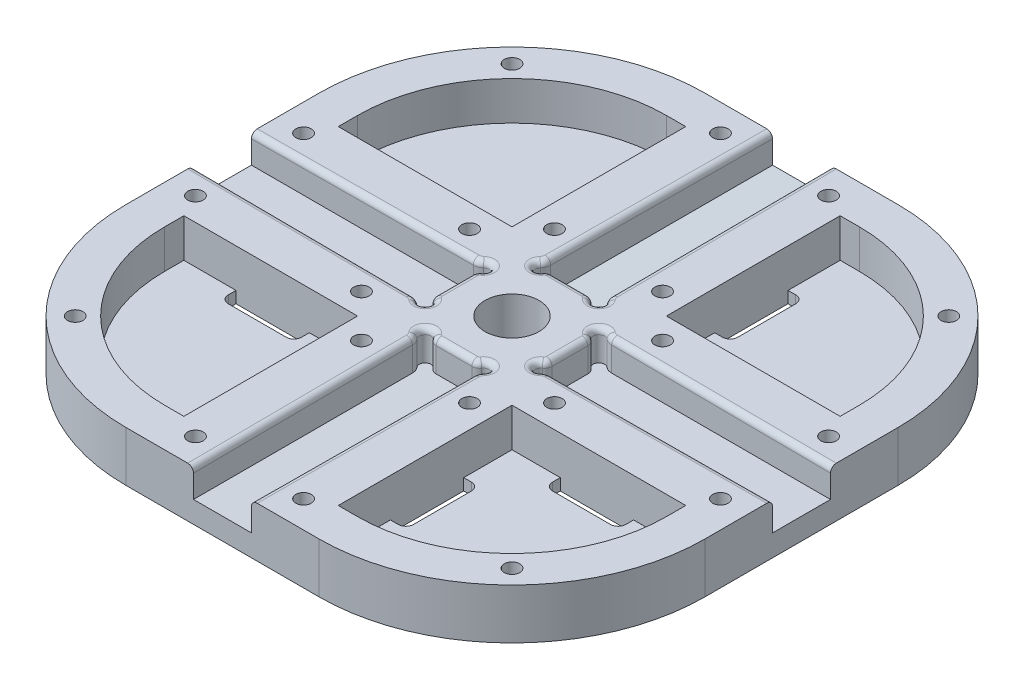
from build123d import *

# Parameters (mm, degrees)
BASE_EXTRUDE1_DEPTH = 13
TUBEPLACE_CUT_DEPTH = 7.4
DRAFT3_ANGLE        = -0.4
DRAFT4_ANGLE        = -0.4
DRAFT5_ANGLE        = -0.4
DRAFT6_ANGLE        = -0.4
SKETCH3_R           = 7
CUT_EXTRUDE2_DEPTH  = 10
CUT_EXTRUDE3_DEPTH  = 107.536378763
FILLET1_R           = 3
FILLET2_R           = 1.5
SKETCH5_R           = 2
CUT_EXTRUDE4_DEPTH  = 107.85972113
SKETCH6_R           = 3.5
CUT_EXTRUDE5_DEPTH  = 9


with BuildPart() as part:
    # Sketch1 → Base-Extrude1 (new body)
    with BuildSketch(Plane(origin=(0, 0, 0), x_dir=(1, 0, 0), z_dir=(0, 1, 0))):
        with BuildLine():
            Line((-25, 75), (25, 75))
            ThreePointArc((25, 75), (60.355339059, 60.355339059), (75, 25))
            Line((75, 25), (75, -25))
            ThreePointArc((75, -25), (60.355339059, -60.355339059), (25, -75))
            Line((25, -75), (-25, -75))
            ThreePointArc((-25, -75), (-60.355339059, -60.355339059), (-75, -25))
            Line((-75, -25), (-75, 25))
            ThreePointArc((-75, 25), (-60.355339059, 60.355339059), (-25, 75))
        make_face()
    extrude(amount=BASE_EXTRUDE1_DEPTH)

    # Sketch2 → TubePlace-Cut (cut)
    with BuildSketch(Plane(origin=(0, 13, 0), x_dir=(1, 0, 0), z_dir=(0, 1, 0))):
        with BuildLine():
            Line((75, 7.5), (75, -7.5))
            Line((75, -7.5), (18.464101615, -7.5))
            Line((18.464101615, -7.5), (16.5, -7.5))
            ThreePointArc((16.5, -7.5), (14.305634925, -8.829607891), (14.142857143, -6.26902229))
            ThreePointArc((14.142857143, -6.26902229), (14.772810521, -5.553538777), (15, -4.627718677))
            Line((15, -4.627718677), (15, 4.627718677))
            ThreePointArc((15, 4.627718677), (14.772810521, 5.553538777), (14.142857143, 6.26902229))
            ThreePointArc((14.142857143, 6.26902229), (14.305634925, 8.829607891), (16.5, 7.5))
            Line((16.5, 7.5), (18.464101615, 7.5))
            Line((18.464101615, 7.5), (75, 7.5))
        make_face()
        with BuildLine():
            Line((-7.5, 75), (7.5, 75))
            Line((7.5, 75), (7.5, 18.464101615))
            Line((7.5, 18.464101615), (7.5, 16.5))
            ThreePointArc((7.5, 16.5), (8.829607891, 14.305634925), (6.26902229, 14.142857143))
            ThreePointArc((6.26902229, 14.142857143), (5.553538777, 14.772810521), (4.627718677, 15))
            Line((4.627718677, 15), (-4.627718677, 15))
            ThreePointArc((-4.627718677, 15), (-5.553538777, 14.772810521), (-6.26902229, 14.142857143))
            ThreePointArc((-6.26902229, 14.142857143), (-8.829607891, 14.305634925), (-7.5, 16.5))
            Line((-7.5, 16.5), (-7.5, 18.464101615))
            Line((-7.5, 18.464101615), (-7.5, 75))
        make_face()
        with BuildLine():
            Line((7.5, -75), (-7.5, -75))
            Line((-7.5, -75), (-7.5, -18.464101615))
            Line((-7.5, -18.464101615), (-7.5, -16.5))
            ThreePointArc((-7.5, -16.5), (-8.829607891, -14.305634925), (-6.26902229, -14.142857143))
            ThreePointArc((-6.26902229, -14.142857143), (-5.553538777, -14.772810521), (-4.627718677, -15))
            Line((-4.627718677, -15), (4.627718677, -15))
            ThreePointArc((4.627718677, -15), (5.553538777, -14.772810521), (6.26902229, -14.142857143))
            ThreePointArc((6.26902229, -14.142857143), (8.829607891, -14.305634925), (7.5, -16.5))
            Line((7.5, -16.5), (7.5, -18.464101615))
            Line((7.5, -18.464101615), (7.5, -75))
        make_face()
        with BuildLine():
            Line((-75, -7.5), (-75, 7.5))
            Line((-75, 7.5), (-18.464101615, 7.5))
            Line((-18.464101615, 7.5), (-16.5, 7.5))
            ThreePointArc((-16.5, 7.5), (-14.305634925, 8.829607891), (-14.142857143, 6.26902229))
            ThreePointArc((-14.142857143, 6.26902229), (-14.772810521, 5.553538777), (-15, 4.627718677))
            Line((-15, 4.627718677), (-15, -4.627718677))
            ThreePointArc((-15, -4.627718677), (-14.772810521, -5.553538777), (-14.142857143, -6.26902229))
            ThreePointArc((-14.142857143, -6.26902229), (-14.305634925, -8.829607891), (-16.5, -7.5))
            Line((-16.5, -7.5), (-18.464101615, -7.5))
            Line((-18.464101615, -7.5), (-75, -7.5))
        make_face()
    extrude(amount=-TUBEPLACE_CUT_DEPTH, mode=Mode.SUBTRACT)

    # Draft3
    draft3_faces = [part.faces().sort_by_distance(p)[0] for p in [
        (0, 5.6, 44.630992796),
        (-7.5, 9.3, 45.75),
        (7.5, 9.3, 45.75),
    ]]
    draft(draft3_faces, Plane(origin=(-25, 13, 75), x_dir=(1, 0, 0), z_dir=(0, 0, 1)), DRAFT3_ANGLE)

    # Draft4
    draft4_faces = [part.faces().sort_by_distance(p)[0] for p in [
        (45.75, 9.3, 7.5),
        (45.75, 9.3, -7.5),
        (44.630992796, 5.6, 0),
    ]]
    draft(draft4_faces, Plane(origin=(75, 13, -25), x_dir=(0, 0, 1), z_dir=(1, 0, 0)), DRAFT4_ANGLE)

    # Draft5
    draft5_faces = [part.faces().sort_by_distance(p)[0] for p in [
        (7.5, 9.3, -45.75),
        (0, 5.6, -44.630992796),
        (-7.5, 9.3, -45.75),
    ]]
    draft(draft5_faces, Plane(origin=(-25, 13, -75), x_dir=(-1, 0, 0), z_dir=(0, 0, -1)), DRAFT5_ANGLE)

    # Draft6
    draft6_faces = [part.faces().sort_by_distance(p)[0] for p in [
        (-44.630992796, 5.6, 0),
        (-45.75, 9.3, -7.5),
        (-45.75, 9.3, 7.5),
    ]]
    draft(draft6_faces, Plane(origin=(-75, 13, -25), x_dir=(0, 0, -1), z_dir=(-1, 0, 0)), DRAFT6_ANGLE)

    # Sketch3 → Cut-Extrude2 (cut)
    with BuildSketch(Plane(origin=(0, 13, 0), x_dir=(1, 0, 0), z_dir=(0, 1, 0))):
        with Locations(Location((0, 0, 0), (0, 0, 270))):
            Circle(SKETCH3_R)
        with BuildLine():
            Line((-25, 65), (-20, 65))
            Line((-20, 65), (-20, 20))
            Line((-20, 20), (-65, 20))
            Line((-65, 20), (-65, 25))
            ThreePointArc((-65, 25), (-53.284271247, 53.284271247), (-25, 65))
        make_face()
        with BuildLine():
            Line((20, 65), (25, 65))
            ThreePointArc((25, 65), (53.284271247, 53.284271247), (65, 25))
            Line((65, 25), (65, 20))
            Line((65, 20), (20, 20))
            Line((20, 20), (20, 65))
        make_face()
        with BuildLine():
            Line((65, -20), (65, -25))
            ThreePointArc((65, -25), (53.284271247, -53.284271247), (25, -65))
            Line((25, -65), (20, -65))
            Line((20, -65), (20, -20))
            Line((20, -20), (65, -20))
        make_face()
        with BuildLine():
            Line((-20, -65), (-25, -65))
            ThreePointArc((-25, -65), (-53.284271247, -53.284271247), (-65, -25))
            Line((-65, -25), (-65, -20))
            Line((-65, -20), (-20, -20))
            Line((-20, -20), (-20, -65))
        make_face()
    extrude(amount=-CUT_EXTRUDE2_DEPTH, mode=Mode.SUBTRACT)

    # Sketch4 → Cut-Extrude3 (cut, through all)
    with BuildSketch(Plane(origin=(0, 3, 0), x_dir=(1, 0, 0), z_dir=(0, 1, 0))):
        with BuildLine():
            Line((-20, 51.5), (-20, 32.5))
            Line((-20, 32.5), (-22, 32.5))
            ThreePointArc((-22, 32.5), (-23.414213562, 33.085786438), (-24, 34.5))
            Line((-24, 34.5), (-24, 49.5))
            ThreePointArc((-24, 49.5), (-23.414213562, 50.914213562), (-22, 51.5))
            Line((-22, 51.5), (-20, 51.5))
        make_face()
        with BuildLine():
            Line((-51.5, 20), (-32.5, 20))
            Line((-32.5, 20), (-32.5, 22))
            ThreePointArc((-32.5, 22), (-33.085786438, 23.414213562), (-34.5, 24))
            Line((-34.5, 24), (-49.5, 24))
            ThreePointArc((-49.5, 24), (-50.914213562, 23.414213562), (-51.5, 22))
            Line((-51.5, 22), (-51.5, 20))
        make_face()
        with BuildLine():
            Line((51.5, 22), (51.5, 20))
            Line((51.5, 20), (32.5, 20))
            Line((32.5, 20), (32.5, 22))
            ThreePointArc((32.5, 22), (33.085786438, 23.414213562), (34.5, 24))
            Line((34.5, 24), (49.5, 24))
            ThreePointArc((49.5, 24), (50.914213562, 23.414213562), (51.5, 22))
        make_face()
        with BuildLine():
            Line((24, 49.5), (24, 34.5))
            ThreePointArc((24, 34.5), (23.414213562, 33.085786438), (22, 32.5))
            Line((22, 32.5), (20, 32.5))
            Line((20, 32.5), (20, 51.5))
            Line((20, 51.5), (22, 51.5))
            ThreePointArc((22, 51.5), (23.414213562, 50.914213562), (24, 49.5))
        make_face()
        with BuildLine():
            Line((22, -51.5), (20, -51.5))
            Line((20, -51.5), (20, -32.5))
            Line((20, -32.5), (22, -32.5))
            ThreePointArc((22, -32.5), (23.414213562, -33.085786438), (24, -34.5))
            Line((24, -34.5), (24, -49.5))
            ThreePointArc((24, -49.5), (23.414213562, -50.914213562), (22, -51.5))
        make_face()
        with BuildLine():
            Line((49.5, -24), (34.5, -24))
            ThreePointArc((34.5, -24), (33.085786438, -23.414213562), (32.5, -22))
            Line((32.5, -22), (32.5, -20))
            Line((32.5, -20), (51.5, -20))
            Line((51.5, -20), (51.5, -22))
            ThreePointArc((51.5, -22), (50.914213562, -23.414213562), (49.5, -24))
        make_face()
        with BuildLine():
            Line((-51.5, -22), (-51.5, -20))
            Line((-51.5, -20), (-32.5, -20))
            Line((-32.5, -20), (-32.5, -22))
            ThreePointArc((-32.5, -22), (-33.085786438, -23.414213562), (-34.5, -24))
            Line((-34.5, -24), (-49.5, -24))
            ThreePointArc((-49.5, -24), (-50.914213562, -23.414213562), (-51.5, -22))
        make_face()
        with BuildLine():
            Line((-24, -49.5), (-24, -34.5))
            ThreePointArc((-24, -34.5), (-23.414213562, -33.085786438), (-22, -32.5))
            Line((-22, -32.5), (-20, -32.5))
            Line((-20, -32.5), (-20, -51.5))
            Line((-20, -51.5), (-22, -51.5))
            ThreePointArc((-22, -51.5), (-23.414213562, -50.914213562), (-24, -49.5))
        make_face()
    extrude(amount=-CUT_EXTRUDE3_DEPTH, mode=Mode.SUBTRACT)

    # Fillet1
    fillet1_edges = [part.edges().sort_by_distance(p)[0] for p in [
        (16.443216649, 9.095594945, 7.908810109),
        (16.443216649, 9.095594945, -7.908810109),
        (7.908810109, 9.095594945, 16.443216649),
        (-7.908810109, 9.095594945, 16.443216649),
        (-16.443216649, 9.095594945, 7.908810109),
        (-16.443216649, 9.095594945, -7.908810109),
        (7.908810109, 9.095594945, -16.443216649),
        (-7.908810109, 9.095594945, -16.443216649),
    ]]
    fillet(fillet1_edges, radius=FILLET1_R)

    # Fillet2
    fillet2_edges = [part.edges().sort_by_distance(p)[0] for p in [
        (5.553538777, 13, -14.772810521),
        (8.421507632, 13, -13.816436025),
        (-7.699219233, 13, -46.464410554),
        (-5.553538777, 13, -14.772810521),
        (0, 13, -15),
        (46.464410554, 13, 7.699219233),
        (7.699219233, 13, -46.464410554),
        (-8.421507632, 13, -13.816436025),
        (-46.464410554, 13, -7.699219233),
        (-13.816436025, 13, 8.421507632),
        (-7.699219233, 13, 46.464410554),
        (8.421507632, 13, 13.816436025),
        (13.816436025, 13, -8.421507632),
        (-8.091643165, 13, -16.890373302),
        (8.091643165, 13, -16.890373302),
        (-16.890373302, 13, -8.091643165),
        (-16.890373302, 13, 8.091643165),
        (-8.091643165, 13, 16.890373302),
        (8.091643165, 13, 16.890373302),
        (16.890373302, 13, -8.091643165),
        (16.890373302, 13, 8.091643165),
        (13.816436025, 13, 8.421507632),
        (46.464410554, 13, -7.699219233),
        (14.772810521, 13, -5.553538777),
        (15, 13, 0),
        (14.772810521, 13, 5.553538777),
        (-8.421507632, 13, 13.816436025),
        (7.699219233, 13, 46.464410554),
        (5.553538777, 13, 14.772810521),
        (0, 13, 15),
        (-5.553538777, 13, 14.772810521),
        (-13.816436025, 13, -8.421507632),
        (-46.464410554, 13, 7.699219233),
        (-14.772810521, 13, 5.553538777),
        (-15, 13, 0),
        (-14.772810521, 13, -5.553538777),
    ]]
    fillet(fillet2_edges, radius=FILLET2_R)

    # Sketch5 → Cut-Extrude4 (cut, through all)
    with BuildSketch(Plane(origin=(0, 13, 0), x_dir=(1, 0, 0), z_dir=(0, 1, 0))):
        with Locations(Location((-14, 68, 0), (0, 0, 270))):
            Circle(SKETCH5_R)
        with Locations(Location((-68, 14, 0), (0, 0, 270))):
            Circle(SKETCH5_R)
        with Locations(Location((-56.568542495, 56.568542495, 0), (0, 0, 270))):
            Circle(SKETCH5_R)
        with Locations(Location((-14, 25, 0), (0, 0, 270))):
            Circle(SKETCH5_R)
        with Locations(Location((-25, 14, 0), (0, 0, 270))):
            Circle(SKETCH5_R)
        with Locations(Location((56.568542495, 56.568542495, 0), (0, 0, 270))):
            Circle(SKETCH5_R)
        with Locations(Location((14, 68, 0), (0, 0, 270))):
            Circle(SKETCH5_R)
        with Locations(Location((14, 25, 0), (0, 0, 270))):
            Circle(SKETCH5_R)
        with Locations(Location((25, 14, 0), (0, 0, 270))):
            Circle(SKETCH5_R)
        with Locations(Location((68, 14, 0), (0, 0, 270))):
            Circle(SKETCH5_R)
        with Locations(Location((56.568542495, -56.568542495, 0), (0, 0, 270))):
            Circle(SKETCH5_R)
        with Locations(Location((68, -14, 0), (0, 0, 270))):
            Circle(SKETCH5_R)
        with Locations(Location((25, -14, 0), (0, 0, 270))):
            Circle(SKETCH5_R)
        with Locations(Location((14, -25, 0), (0, 0, 270))):
            Circle(SKETCH5_R)
        with Locations(Location((14, -68, 0), (0, 0, 270))):
            Circle(SKETCH5_R)
        with Locations(Location((-56.568542495, -56.568542495, 0), (0, 0, 270))):
            Circle(SKETCH5_R)
        with Locations(Location((-14, -68, 0), (0, 0, 270))):
            Circle(SKETCH5_R)
        with Locations(Location((-14, -25, 0), (0, 0, 270))):
            Circle(SKETCH5_R)
        with Locations(Location((-25, -14, 0), (0, 0, 270))):
            Circle(SKETCH5_R)
        with Locations(Location((-68, -14, 0), (0, 0, 270))):
            Circle(SKETCH5_R)
    extrude(amount=-CUT_EXTRUDE4_DEPTH, mode=Mode.SUBTRACT)

    # Sketch6 → Cut-Extrude5 (cut)
    with BuildSketch(Plane.XZ):
        with Locations(Location((-14, 68, 0), (0, 0, 270))):
            Circle(SKETCH6_R)
        with Locations(Location((-14, 25, 0), (0, 0, 270))):
            Circle(SKETCH6_R)
        with Locations(Location((-25, 14, 0), (0, 0, 270))):
            Circle(SKETCH6_R)
        with Locations(Location((-56.568542495, 56.568542495, 0), (0, 0, 270))):
            Circle(SKETCH6_R)
        with Locations(Location((-68, 14, 0), (0, 0, 270))):
            Circle(SKETCH6_R)
        with Locations(Location((68, 14, 0), (0, 0, 270))):
            Circle(SKETCH6_R)
        with Locations(Location((56.568542495, 56.568542495, 0), (0, 0, 270))):
            Circle(SKETCH6_R)
        with Locations(Location((14, 68, 0), (0, 0, 270))):
            Circle(SKETCH6_R)
        with Locations(Location((14, 25, 0), (0, 0, 270))):
            Circle(SKETCH6_R)
        with Locations(Location((25, 14, 0), (0, 0, 270))):
            Circle(SKETCH6_R)
        with Locations(Location((14, -68, 0), (0, 0, 270))):
            Circle(SKETCH6_R)
        with Locations(Location((56.568542495, -56.568542495, 0), (0, 0, 270))):
            Circle(SKETCH6_R)
        with Locations(Location((68, -14, 0), (0, 0, 270))):
            Circle(SKETCH6_R)
        with Locations(Location((25, -14, 0), (0, 0, 270))):
            Circle(SKETCH6_R)
        with Locations(Location((14, -25, 0), (0, 0, 270))):
            Circle(SKETCH6_R)
        with Locations(Location((-68, -14, 0), (0, 0, 270))):
            Circle(SKETCH6_R)
        with Locations(Location((-56.568542495, -56.568542495, 0), (0, 0, 270))):
            Circle(SKETCH6_R)
        with Locations(Location((-14, -68, 0), (0, 0, 270))):
            Circle(SKETCH6_R)
        with Locations(Location((-14, -25, 0), (0, 0, 270))):
            Circle(SKETCH6_R)
        with Locations(Location((-25, -14, 0), (0, 0, 270))):
            Circle(SKETCH6_R)
    extrude(amount=-CUT_EXTRUDE5_DEPTH, mode=Mode.SUBTRACT)


solid = part.part
